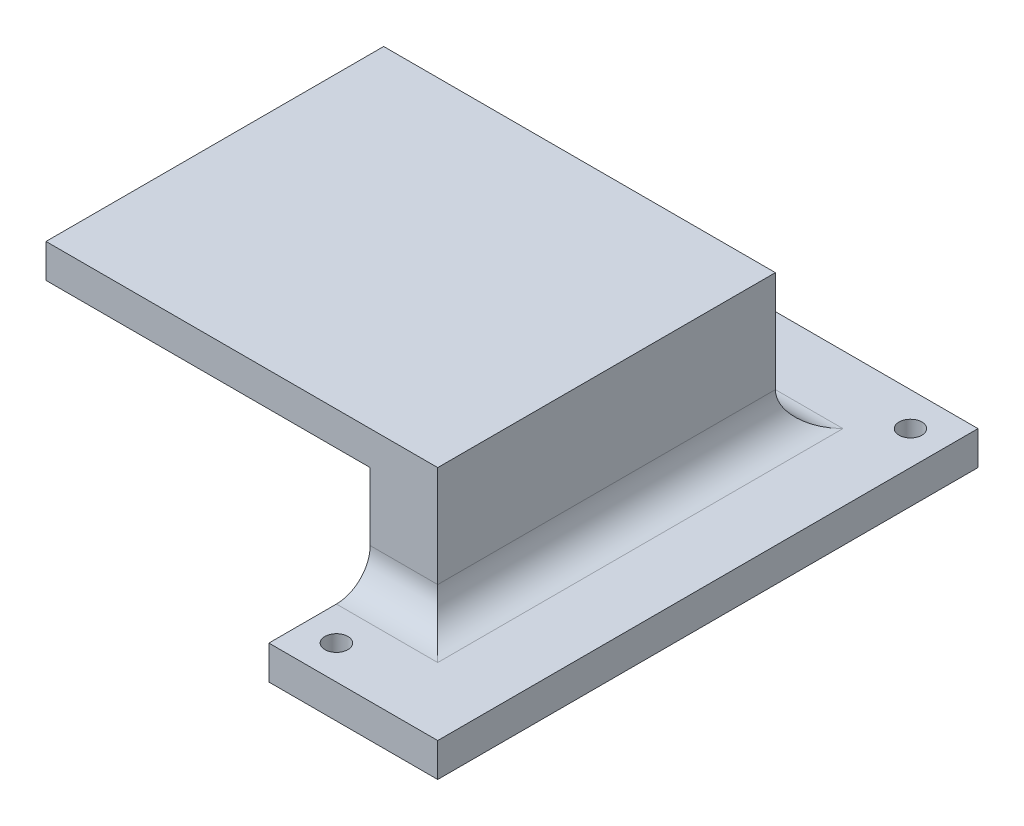
from build123d import *

# Parameters (mm, degrees)
SKETCH_1_R          = 1.7
EXTRUDE_1_DEPTH     = 5
EXTRUDE_2_DEPTH     = 15
SKETCH_3_W          = 58
SKETCH_3_H          = 50
EXTRUDE_3_DEPTH     = 5
SKETCH_4_W          = 5
SKETCH_4_H          = 20
EXTRUDE_4_DEPTH     = 7
SKETCH_6_R          = 1.35
CUT_EXTRUDE_1_DEPTH = 8
FILLET_1_R          = 5


with BuildPart() as part:
    # 草图1 → 凸台-拉伸1 (new body)
    with BuildSketch(Plane(origin=(0, 0, 0), x_dir=(1, 0, 0), z_dir=(0, 1, 0))):
        Polygon((24, 27.5), (24, -27.5), (49, -27.5), (49, 52.5), (-24, 52.5), (-24, 27.5), align=None)
        with Locations(Location((29, -22.5, 0), (0, 0, 270))):
            Circle(SKETCH_1_R, mode=Mode.SUBTRACT)
        with Locations(Location((44, 47.5, 0), (0, 0, 270))):
            Circle(SKETCH_1_R, mode=Mode.SUBTRACT)
        with Locations(Location((-19, 47.5, 0), (0, 0, 270))):
            Circle(SKETCH_1_R, mode=Mode.SUBTRACT)
    extrude(amount=EXTRUDE_1_DEPTH)

    # 草图2 → 凸台-拉伸2 (add)
    with BuildSketch(Plane(origin=(0, 5, 0), x_dir=(1, 0, 0), z_dir=(0, 1, 0))):
        Polygon((-24, 37.5), (-24, 27.5), (24, 27.5), (24, -12.5), (34, -12.5), (34, 37.5), align=None)
    extrude(amount=EXTRUDE_2_DEPTH)

    # 草图3 → 凸台-拉伸3 (add)
    with BuildSketch(Plane(origin=(0, 20, 0), x_dir=(1, 0, 0), z_dir=(0, 1, 0))):
        with Locations((5, 12.5)):
            Rectangle(SKETCH_3_W, SKETCH_3_H)
    extrude(amount=EXTRUDE_3_DEPTH)

    # 草图4 → 凸台-拉伸4 (add)
    with BuildSketch(Plane.ZY.offset(-24)):
        with Locations((-4, 10)):
            Rectangle(SKETCH_4_W, SKETCH_4_H)
    extrude(amount=EXTRUDE_4_DEPTH)

    # 草图6 → 切除-拉伸1 (cut)
    with BuildSketch(Plane.XY.offset(-1.5)):
        with Locations((20.65, 15)):
            Circle(SKETCH_6_R)
        with Locations((20.65, 5)):
            Circle(SKETCH_6_R)
    extrude(amount=-CUT_EXTRUDE_1_DEPTH, mode=Mode.SUBTRACT)

    # 圆角1
    fillet_1_edges = [part.edges().sort_by_distance(p)[0] for p in [
        (34, 5, -12.5),
        (5, 5, -37.5),
        (29, 5, 12.5),
    ]]
    fillet(fillet_1_edges, radius=FILLET_1_R)


solid = part.part
